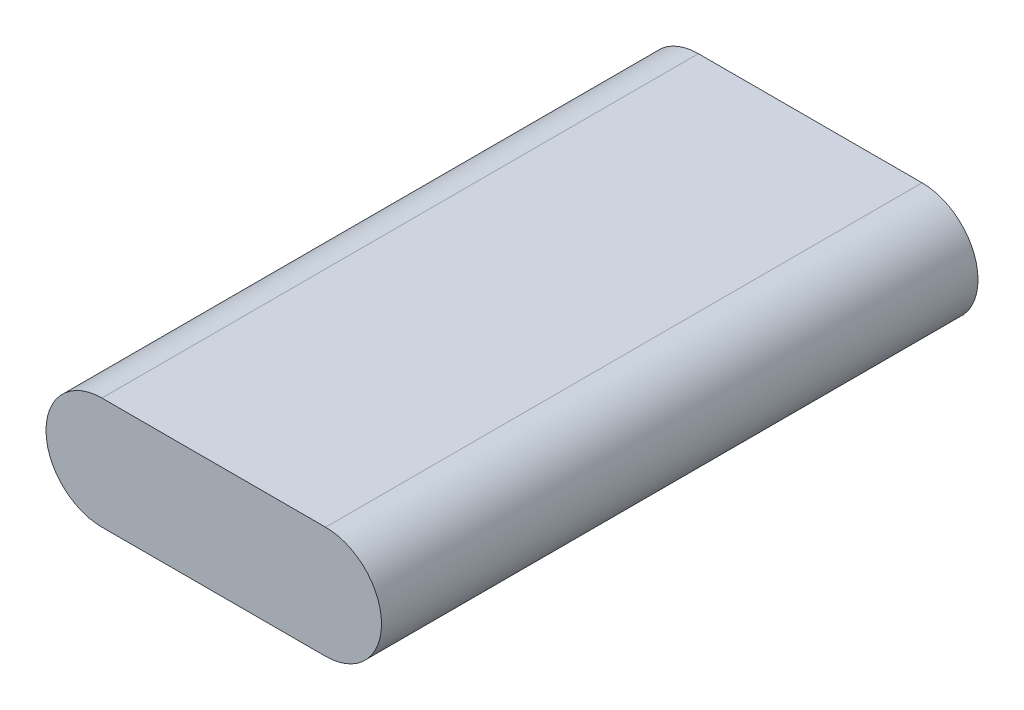
from build123d import *

# Parameters (mm, degrees)
BOSS_EXTRUDE1_DEPTH = 80


with BuildPart() as part:
    # Sketch1 → Boss-Extrude1 (new body)
    with BuildSketch(Plane.XY):
        with BuildLine():
            Line((0, 7.5), (30, 7.5))
            ThreePointArc((30, 7.5), (37.5, 0), (30, -7.5))
            Line((30, -7.5), (0, -7.5))
            ThreePointArc((0, -7.5), (-7.5, 0), (0, 7.5))
        make_face()
    extrude(amount=BOSS_EXTRUDE1_DEPTH)


solid = part.part
